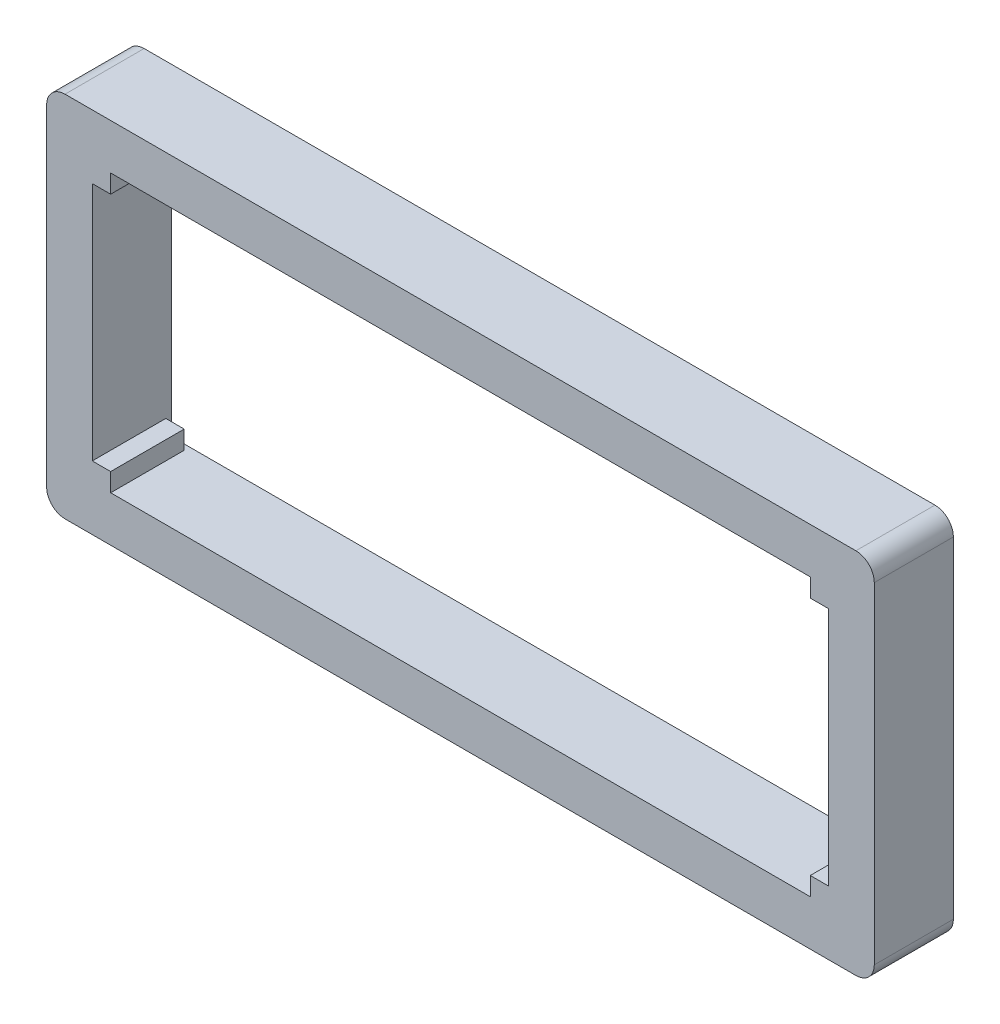
from build123d import *

# Parameters (mm, degrees)
SKETCH1_W           = 225
SKETCH1_H           = 100
SKETCH1_W_2         = 200.2
SKETCH1_H_2         = 75.3
BOSS_EXTRUDE1_DEPTH = 1.5
SKETCH2_W           = 225
SKETCH2_H           = 100
SKETCH2_W_2         = 5
SKETCH2_H_2         = 5
BOSS_EXTRUDE2_DEPTH = 20
FILLET1_R           = 5


with BuildPart() as part:
    # Sketch1 → Boss-Extrude1 (new body)
    with BuildSketch(Plane.XY):
        with Locations((100.1, 37.65)):
            Rectangle(SKETCH1_W, SKETCH1_H)
        with Locations((100.1, 37.65)):
            Rectangle(SKETCH1_W_2, SKETCH1_H_2, mode=Mode.SUBTRACT)
    extrude(amount=BOSS_EXTRUDE1_DEPTH)

    # Sketch2 → Boss-Extrude2 (add)
    # profile 1 of 5: a face of its own
    with BuildSketch(Plane.XY.offset(1.5)):
        with Locations((100.1, 37.65)):
            Rectangle(SKETCH2_W, SKETCH2_H)
        Polygon((0, 70.3), (0, 75.3), (5, 75.3), (195.2, 75.3), (200.2, 75.3), (200.2, 70.3), (200.2, 5), (200.2, 0), (195.2, 0), (5, 0), (0, 0), (0, 5), align=None, mode=Mode.SUBTRACT)
    # profile 2 of 5: a face of its own
    with BuildSketch(Plane.XY.offset(1.5)):
        with Locations((197.7, 2.5)):
            Rectangle(SKETCH2_W_2, SKETCH2_H_2)
    # profile 3 of 5: a face of its own
    with BuildSketch(Plane.XY.offset(1.5)):
        with Locations((197.7, 72.8)):
            Rectangle(SKETCH2_W_2, SKETCH2_H_2)
    # profile 4 of 5: a face of its own
    with BuildSketch(Plane.XY.offset(1.5)):
        with Locations((2.5, 72.8)):
            Rectangle(SKETCH2_W_2, SKETCH2_H_2)
    # profile 5 of 5: a face of its own
    with BuildSketch(Plane.XY.offset(1.5)):
        with Locations((2.5, 2.5)):
            Rectangle(SKETCH2_W_2, SKETCH2_H_2)
    extrude(amount=BOSS_EXTRUDE2_DEPTH)

    # Fillet1
    fillet1_edges = [part.edges().sort_by_distance(p)[0] for p in [
        (-12.4, 87.65, 10.75),
        (212.6, 87.65, 10.75),
        (212.6, -12.35, 10.75),
        (-12.4, -12.35, 10.75),
    ]]
    fillet(fillet1_edges, radius=FILLET1_R)


solid = part.part
